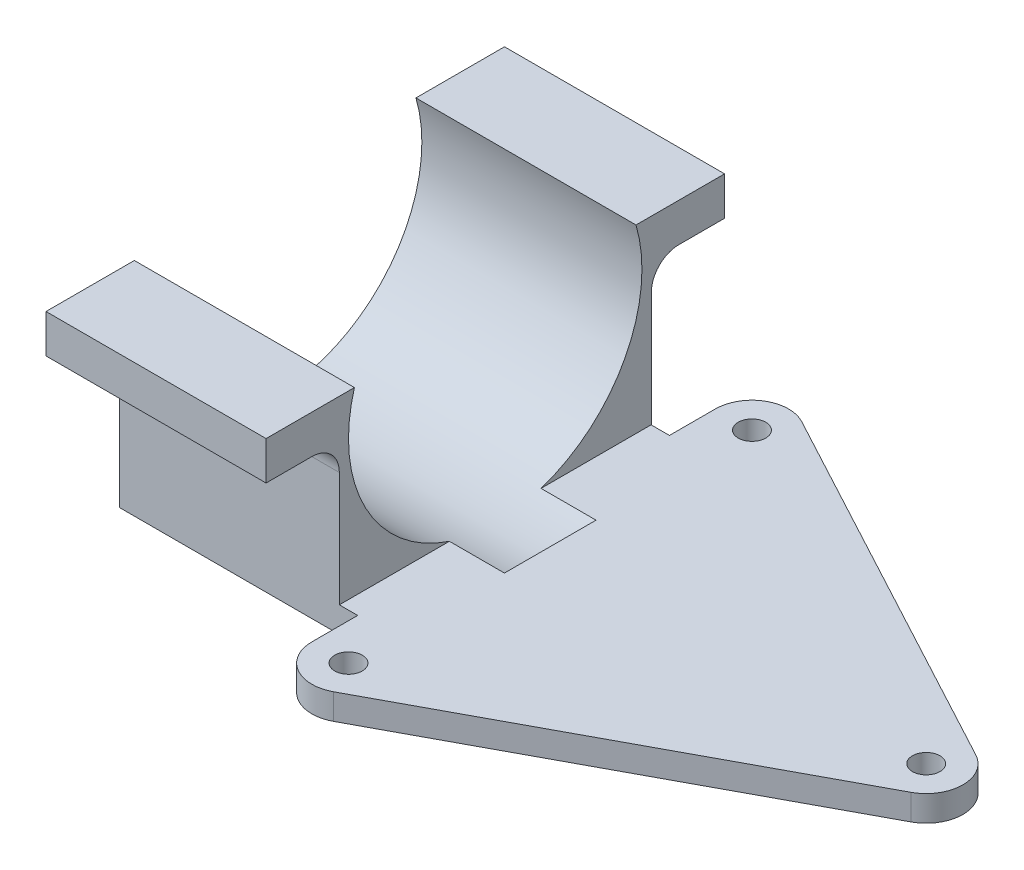
from build123d import *

# Parameters (mm, degrees)
SKETCH_1_R          = 1.5
EXTRUDE_1_DEPTH     = 2.8
EXTRUDE_2_DEPTH     = 15.5
SKETCH_3_W          = 24
SKETCH_3_H          = 50
EXTRUDE_3_DEPTH     = 4.2
SKETCH_4_R          = 16
CUT_EXTRUDE_4_DEPTH = 30
FILLET_1_R          = 3


with BuildPart() as part:
    # Эскиз1 → Вытянуть1 (new body)
    with BuildSketch(Plane(origin=(0, 0, 0), x_dir=(1, 0, 0), z_dir=(0, 1, 0))):
        with BuildLine():
            Line((0, 22), (0, 17))
            Line((0, 17), (-26, 17))
            Line((-26, 17), (-26, 0))
            Line((-26, 0), (-26, -17))
            Line((-26, -17), (0, -17))
            Line((0, -17), (0, -22))
            ThreePointArc((0, -22), (1.94635486, -25.432570704), (5.891270819, -25.524641072))
            Line((5.891270819, -25.524641072), (46.891270819, -3.524641072))
            ThreePointArc((46.891270819, -3.524641072), (49, 0), (46.891270819, 3.524641072))
            Line((46.891270819, 3.524641072), (5.891270819, 25.524641072))
            ThreePointArc((5.891270819, 25.524641072), (1.94635486, 25.432570704), (0, 22))
        make_face()
        with Locations(Location((4, 22, 0), (0, 0, 270))):
            Circle(SKETCH_1_R, mode=Mode.SUBTRACT)
        with Locations(Location((4, -22, 0), (0, 0, 270))):
            Circle(SKETCH_1_R, mode=Mode.SUBTRACT)
        with Locations(Location((45, 0, 0), (0, 0, 270))):
            Circle(SKETCH_1_R, mode=Mode.SUBTRACT)
    extrude(amount=EXTRUDE_1_DEPTH)

    # Эскиз2 → Вытянуть2 (add)
    with BuildSketch(Plane(origin=(0, 2.8, 0), x_dir=(1, 0, 0), z_dir=(0, 1, 0))):
        Polygon((-2, 17.022348164), (-26, 17), (-26, -17), (-2, -17), align=None)
    extrude(amount=EXTRUDE_2_DEPTH)

    # Эскиз3 → Вытянуть3 (add)
    with BuildSketch(Plane(origin=(0, 18.3, 0), x_dir=(1, 0, 0), z_dir=(0, 1, 0))):
        with Locations((-14, 0.011174082)):
            Rectangle(SKETCH_3_W, SKETCH_3_H)
    extrude(amount=EXTRUDE_3_DEPTH)

    # Эскиз4 → Вытянуть4 (cut)
    with BuildSketch(Plane.ZY.offset(26)):
        with Locations((0, 18)):
            Circle(SKETCH_4_R)
    extrude(amount=-CUT_EXTRUDE_4_DEPTH, mode=Mode.SUBTRACT)

    # Скругление1
    fillet_1_edges = [part.edges().sort_by_distance(p)[0] for p in [
        (-14, 18.3, -17.011174082),
        (-14, 18.3, 17),
    ]]
    fillet(fillet_1_edges, radius=FILLET_1_R)


solid = part.part
